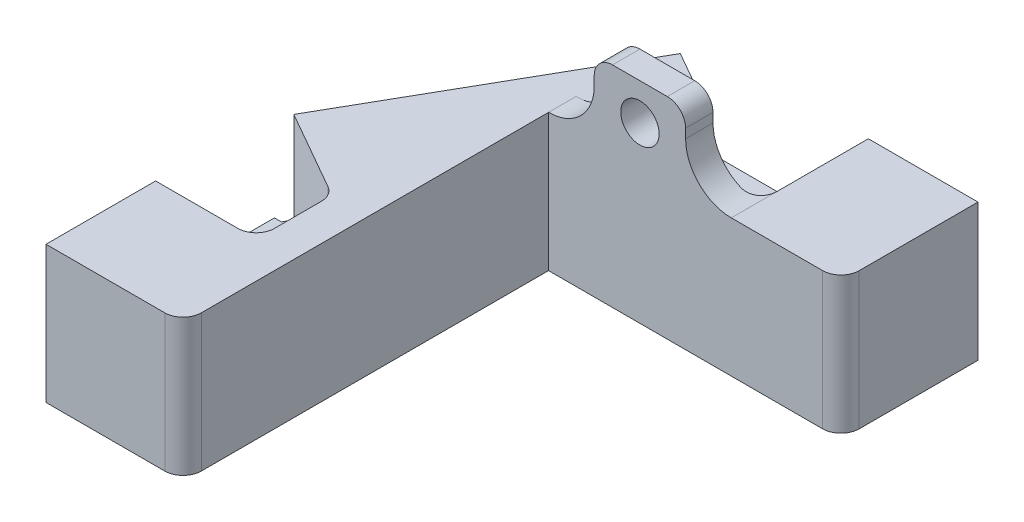
from build123d import *

# Parameters (mm, degrees)
BOSS_EXTRU_1_DEPTH      = 5
BOSS_EXTRU_2_DEPTH      = 10
ESQUISSE4_R             = 2.8
ENL_V_MAT_EXTRU_1_DEPTH = 9.1
ESQUISSE5_R             = 2.8
ENL_V_MAT_EXTRU_2_DEPTH = 9.1
ESQUISSE6_R             = 2.8
ENL_V_MAT_EXTRU_3_DEPTH = 9.1
BOSS_EXTRU_3_DEPTH      = 8
ESQUISSE8_R             = 2.1
ENL_V_MAT_EXTRU_5_DEPTH = 9.1
ESQUISSE9_R             = 2.1
ENL_V_MAT_EXTRU_6_DEPTH = 14
CONG_2_R                = 5
CONG_1_R                = 2


with BuildPart() as part:
    # Esquisse2 → Boss.-Extru.1 (new body)
    with BuildSketch(Plane(origin=(0, 0, 0), x_dir=(1, 0, 0), z_dir=(0, 1, 0))):
        Polygon((20, 0), (0, 0), (0, -20), (0, -40), (-15, -40), (-15, -15), (-14.241244466, -15), (2.1313405, 13.65202369), (0, 15), (32, 15), (32, 0), align=None)
    extrude(amount=BOSS_EXTRU_1_DEPTH)

    # Esquisse3 → Boss.-Extru.2 (add)
    with BuildSketch(Plane(origin=(0, 5, 0), x_dir=(1, 0, 0), z_dir=(0, 1, 0))):
        Polygon((32, 15), (20, 15), (20, 3), (8.713731996, 3), (8.713731996, 8.738906014), (1.635201562, 12.783780548), (-13.745105527, -14.131756858), (-4, -19.700388588), (-4, -28), (-15, -28), (-15, -40), (0, -40), (0, 0), (32, 0), align=None)
    extrude(amount=BOSS_EXTRU_2_DEPTH)

    # Esquisse4 → Enlèv. mat.-Extru.1 (cut)
    with BuildSketch(Plane(origin=(-4.274168905, 0, -2.442382231), x_dir=(-0.4961389383568338, 0, 0.8682431421244592), z_dir=(-0.8682431421244592, 0, -0.4961389383568338))):
        with Locations((-6.410716958, 10)):
            Circle(ESQUISSE4_R)
        with Locations((13.589283042, 10)):
            Circle(ESQUISSE4_R)
    extrude(amount=-ENL_V_MAT_EXTRU_1_DEPTH, mode=Mode.SUBTRACT)

    # Esquisse5 → Enlèv. mat.-Extru.2 (cut)
    with BuildSketch(Plane.ZY.offset(15)):
        with Locations((34, 10)):
            Circle(ESQUISSE5_R)
    extrude(amount=-ENL_V_MAT_EXTRU_2_DEPTH, mode=Mode.SUBTRACT)

    # Esquisse6 → Enlèv. mat.-Extru.3 (cut)
    with BuildSketch(Plane(origin=(0, 0, -15), x_dir=(-1, 0, 0), z_dir=(0, 0, -1))):
        with Locations((-26, 10)):
            Circle(ESQUISSE6_R)
    extrude(amount=-ENL_V_MAT_EXTRU_3_DEPTH, mode=Mode.SUBTRACT)

    # Esquisse10 → Boss.-Extru.3 (add)
    with BuildSketch(Plane(origin=(0, 15, 0), x_dir=(1, 0, 0), z_dir=(0, 1, 0))):
        Polygon((15, 3), (8.713731996, 3), (5, 3), (5, 0), (15, 0), align=None)
    extrude(amount=BOSS_EXTRU_3_DEPTH)

    # Esquisse8 → Enlèv. mat.-Extru.5 (cut)
    with BuildSketch(Plane.XY):
        with Locations((10, 19)):
            Circle(ESQUISSE8_R)
    extrude(amount=-ENL_V_MAT_EXTRU_5_DEPTH, mode=Mode.SUBTRACT)

    # Esquisse9 → Enlèv. mat.-Extru.6 (cut)
    with BuildSketch(Plane(origin=(0, 5, 0), x_dir=(1, 0, 0), z_dir=(0, 1, 0))):
        with Locations(Location((-10, -22, 0), (0, 0, 270))):
            Circle(ESQUISSE9_R)
        with Locations(Location((14, 10, 0), (0, 0, 270))):
            Circle(ESQUISSE9_R)
    extrude(amount=-ENL_V_MAT_EXTRU_6_DEPTH, mode=Mode.SUBTRACT)

    # Congé2
    cong_2_edges = [part.edges().sort_by_distance(p)[0] for p in [
        (15, 15, -1.5),
        (5, 15, -1.5),
    ]]
    fillet(cong_2_edges, radius=CONG_2_R)

    # Congé1
    cong_1_edges = [part.edges().sort_by_distance(p)[0] for p in [
        (15, 23, -1.5),
        (5, 23, -1.5),
        (32, 7.5, 0),
        (0, 7.5, 40),
        (20, 10, -3),
        (8.713731996, 10, -8.738906014),
        (-4, 10, 19.700388588),
        (-4, 10, 28),
    ]]
    fillet(cong_1_edges, radius=CONG_1_R)


solid = part.part
